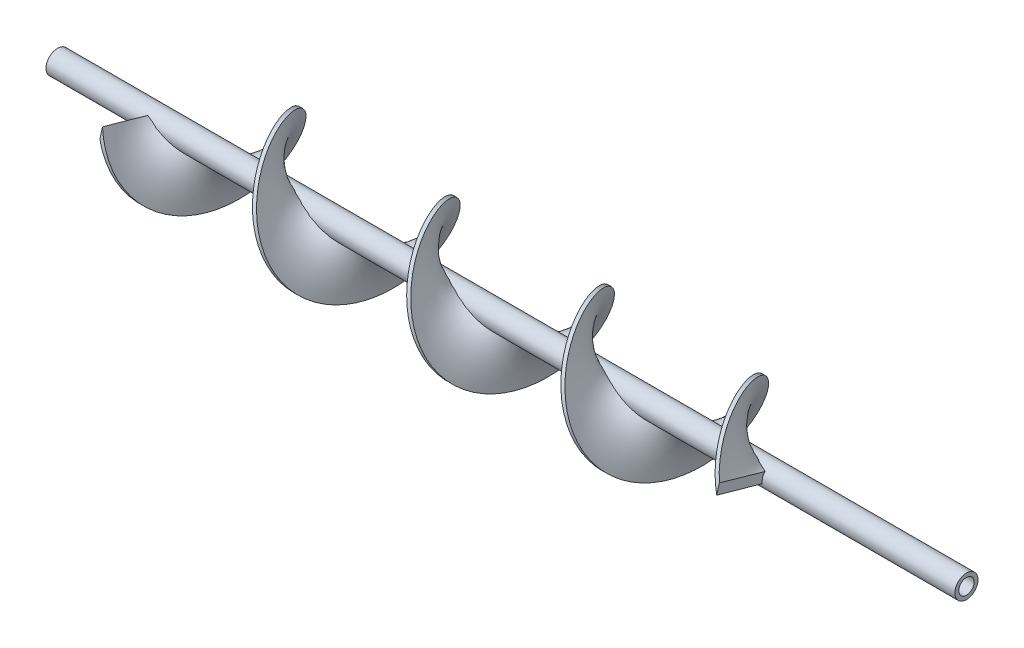
from build123d import *

# Parameters (mm, degrees)
AUFSATZ_LINEAR_AUSTRAGEN1_DEPTH      = 51.5
AUFSATZ_LINEAR_AUSTRAGEN1_DEPTH_BACK = 415
SKIZZE3_R                            = 6
SKIZZE3_R_2                          = 4
AUSTRAGUNG1_PITCH                    = 80
AUSTRAGUNG1_HEIGHT                   = 320
AUSTRAGUNG1_RADIUS                   = 4
SKETCH1_R                            = 6
SKETCH1_R_2                          = 4
BOSS_EXTRUDE1_DEPTH                  = 65
SKETCH2_R                            = 6
CUT_EXTRUDE1_DEPTH                   = 80
SKETCH3_R                            = 6
SKETCH3_R_2                          = 4
BOSS_EXTRUDE2_DEPTH                  = 20


with BuildPart() as part:
    # Skizze3 → Aufsatz-Linear austragen1 (new, two sides: drawn at the far end of the back side and taken through both)
    with BuildSketch(Plane(origin=(0, 0, 0), x_dir=(0, 0, -1), z_dir=(1, 0, 0)).offset(-AUFSATZ_LINEAR_AUSTRAGEN1_DEPTH_BACK)):
        Circle(SKIZZE3_R)
        Circle(SKIZZE3_R_2, mode=Mode.SUBTRACT)
    extrude(amount=AUFSATZ_LINEAR_AUSTRAGEN1_DEPTH + AUFSATZ_LINEAR_AUSTRAGEN1_DEPTH_BACK)

    # Sketch1 → Boss-Extrude1 (add)
    with BuildSketch(Plane(origin=(51.5, 0, 0), x_dir=(0, 0, -1), z_dir=(1, 0, 0))):
        Circle(SKETCH1_R)
        Circle(SKETCH1_R_2, mode=Mode.SUBTRACT)
    extrude(amount=BOSS_EXTRUDE1_DEPTH)

    # Sketch2 → Cut-Extrude1 (cut)
    with BuildSketch(Plane.ZY.offset(415)):
        Circle(SKETCH2_R)
    extrude(amount=-CUT_EXTRUDE1_DEPTH, mode=Mode.SUBTRACT)

    # Sketch3 → Boss-Extrude2 (add)
    with BuildSketch(Plane(origin=(116.5, 0, 0), x_dir=(0, 0, -1), z_dir=(1, 0, 0))):
        with Locations(Location((0, 0, 0), (0, 0, 180))):
            Circle(SKETCH3_R)
        with Locations(Location((0, 0, 0), (0, 0, 180))):
            Circle(SKETCH3_R_2, mode=Mode.SUBTRACT)
    extrude(amount=BOSS_EXTRUDE2_DEPTH)


with BuildPart() as body_2:
    # Austragung1: sweep along a helix
    with BuildLine() as austragung1_path:
        Helix(AUSTRAGUNG1_PITCH, AUSTRAGUNG1_HEIGHT, AUSTRAGUNG1_RADIUS, center=(36.5, 0, 0), direction=(-1, 0, 0))
    # Skizze2 → Austragung1 (sweep)
    with BuildSketch(Plane(origin=(0, 0, 0), x_dir=(0, 0, -1), z_dir=(1, 0, 0))):
        with BuildLine():
            Line((3.122498999, -2.5), (30, -2.5))
            Line((30, -2.5), (30, 2.5))
            Line((30, 2.5), (3.122498999, 2.5))
            ThreePointArc((3.122498999, 2.5), (4, 0), (3.122498999, -2.5))
        make_face()
    sweep(path=austragung1_path.line, is_frenet=True)


solid = Compound([part.part, body_2.part])
